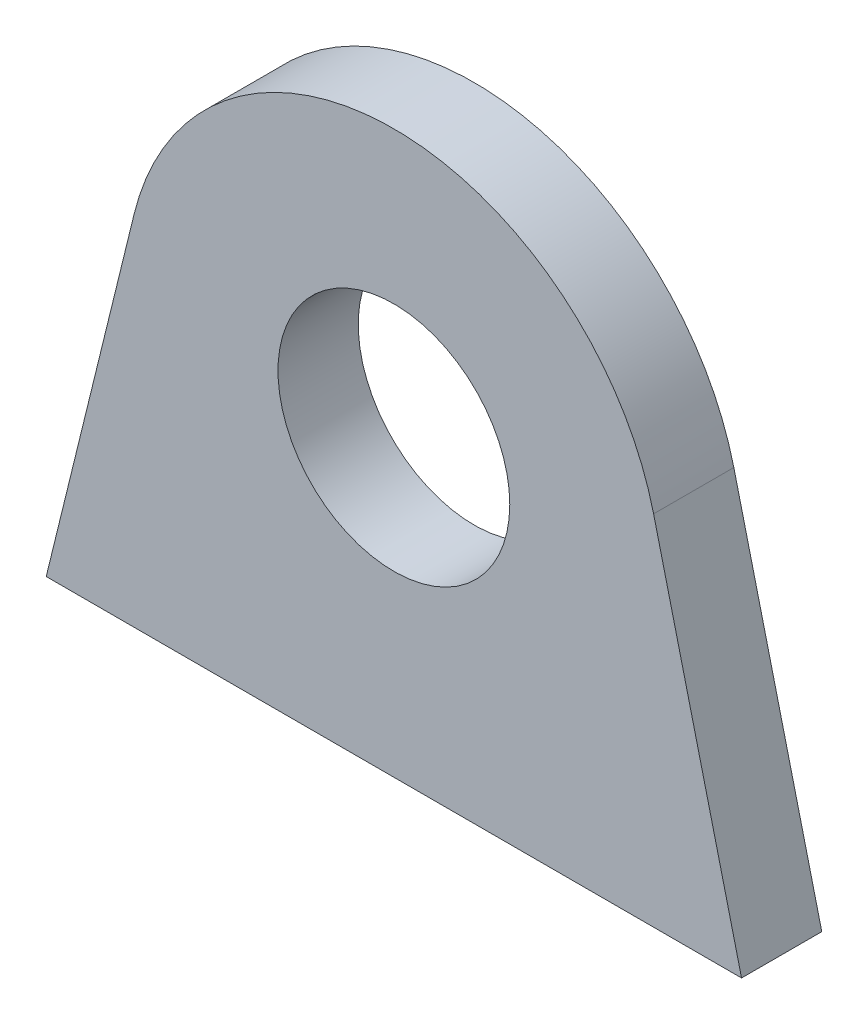
from build123d import *

# Parameters (mm, degrees)
SKETCH1_R           = 13
BOSS_EXTRUDE1_DEPTH = 9


with BuildPart() as part:
    # Sketch1 → Boss-Extrude1 (new body)
    with BuildSketch(Plane.XY):
        with BuildLine():
            Line((-39, -33), (39, -33))
            Line((39, -33), (29.133572718, 7.157858667))
            ThreePointArc((29.133572718, 7.157858667), (0, 30), (-29.133572718, 7.157858667))
            Line((-29.133572718, 7.157858667), (-39, -33))
        make_face()
        Circle(SKETCH1_R, mode=Mode.SUBTRACT)
    extrude(amount=BOSS_EXTRUDE1_DEPTH)


solid = part.part
